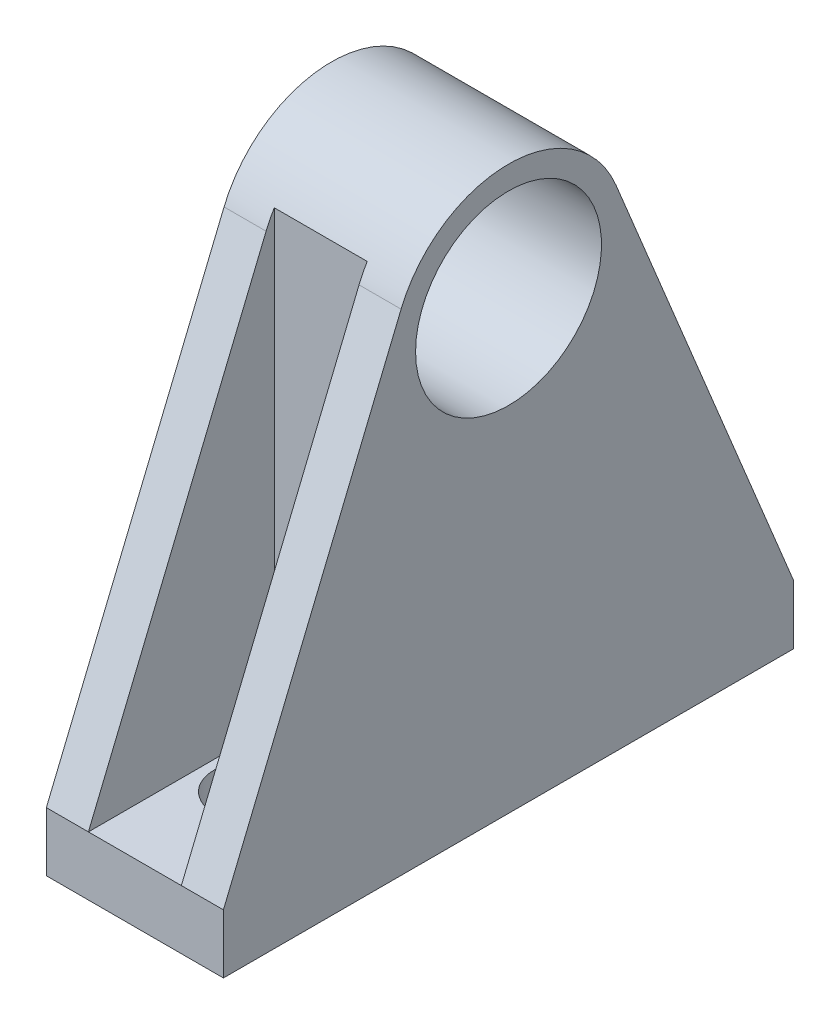
from build123d import *

# Parameters (mm, degrees)
SKETCH1_R           = 10
BOSS_EXTRUDE1_DEPTH = 19.05
SKETCH2_R           = 4
CUT_EXTRUDE1_DEPTH  = 83.63609118
CUT_EXTRUDE2_DEPTH  = 5


with BuildPart() as part:
    # Sketch1 → Boss-Extrude1 (new body)
    with BuildSketch(Plane(origin=(0, 0, 0), x_dir=(0, 0, -1), z_dir=(1, 0, 0))):
        with BuildLine():
            Line((-30.675, 0), (-30.675, 6.35))
            Line((-30.675, 6.35), (-11.55788149, 52.76081668))
            ThreePointArc((-11.55788149, 52.76081668), (0, 60.5), (11.55788149, 52.76081668))
            Line((11.55788149, 52.76081668), (30.675, 6.35))
            Line((30.675, 6.35), (30.675, 0))
            Line((30.675, 0), (-30.675, 0))
        make_face()
        with Locations(Location((0, 48, 0), (0, 0, 180))):
            Circle(SKETCH1_R, mode=Mode.SUBTRACT)
    extrude(amount=BOSS_EXTRUDE1_DEPTH)

    # Sketch2 → Cut-Extrude1 (cut, symmetric)
    with BuildSketch(Plane(origin=(0, 0, 0), x_dir=(1, 0, 0), z_dir=(0, 1, 0))):
        with Locations(Location((9.525, -18.175, 0), (0, 0, 270))):
            Circle(SKETCH2_R)
        with Locations(Location((9.525, 18.175, 0), (0, 0, 270))):
            Circle(SKETCH2_R)
    extrude(amount=CUT_EXTRUDE1_DEPTH, both=True, mode=Mode.SUBTRACT)

    # Sketch3 → Cut-Extrude2 (cut, symmetric)
    with BuildSketch(Plane(origin=(9.525, 0, 0), x_dir=(0, 0, -1), z_dir=(1, 0, 0))):
        Polygon((-10.675, 54.904196759), (-10.675, 6.35), (-30.675, 6.35), align=None)
        Polygon((10.675, 54.904196759), (30.675, 6.35), (10.675, 6.35), align=None)
    extrude(amount=CUT_EXTRUDE2_DEPTH, both=True, mode=Mode.SUBTRACT)


solid = part.part
